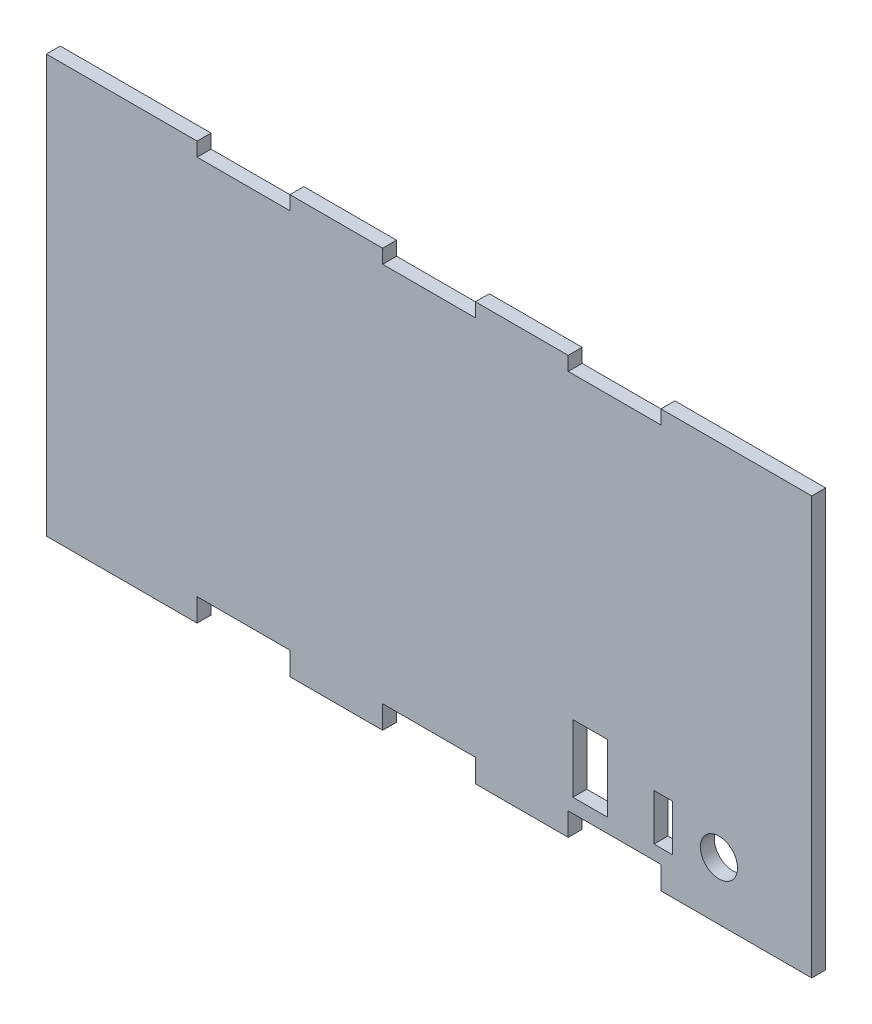
from build123d import *

# Parameters (mm, degrees)
ESQUISSE1_W             = 330
ESQUISSE1_H             = 180
BOSS_EXTRU_1_DEPTH      = 6
ESQUISSE2_W             = 40
ESQUISSE2_H             = 6
ESQUISSE2_H_2           = 9.903585907
ENL_V_MAT_ENCOCHE_DEPTH = 6
ESQUISSE3_R             = 8
ESQUISSE3_W             = 15
ESQUISSE3_H             = 29
ESQUISSE3_W_2           = 8
ESQUISSE3_H_2           = 20
ENL_V_MAT_EXTRU_1_DEPTH = 10


with BuildPart() as part:
    # Esquisse1 → Boss.-Extru.1 (new body)
    with BuildSketch(Plane.XY):
        with Locations((-165, 90)):
            Rectangle(ESQUISSE1_W, ESQUISSE1_H)
    extrude(amount=BOSS_EXTRU_1_DEPTH)

    # Esquisse2 → Enlèv. mat encoche (cut)
    with BuildSketch(Plane.XY.offset(6)):
        with Locations((-245, 177)):
            Rectangle(ESQUISSE2_W, ESQUISSE2_H)
        with Locations((-165, 177)):
            Rectangle(ESQUISSE2_W, ESQUISSE2_H)
        with Locations((-85, 177)):
            Rectangle(ESQUISSE2_W, ESQUISSE2_H)
        with Locations((-245, 4.951792954)):
            Rectangle(ESQUISSE2_W, ESQUISSE2_H_2)
        with Locations((-165, 4.951792954)):
            Rectangle(ESQUISSE2_W, ESQUISSE2_H_2)
        with Locations((-85, 4.951792954)):
            Rectangle(ESQUISSE2_W, ESQUISSE2_H_2)
    extrude(amount=-ENL_V_MAT_ENCOCHE_DEPTH, mode=Mode.SUBTRACT)

    # Esquisse3 → Enlèv. mat.-Extru.1 (cut)
    with BuildSketch(Plane.XY.offset(6)):
        with Locations((-40, 25)):
            Circle(ESQUISSE3_R)
        with Locations((-95.5, 30.5)):
            Rectangle(ESQUISSE3_W, ESQUISSE3_H)
        with Locations((-64, 26)):
            Rectangle(ESQUISSE3_W_2, ESQUISSE3_H_2)
    extrude(amount=-ENL_V_MAT_EXTRU_1_DEPTH, mode=Mode.SUBTRACT)


solid = part.part
